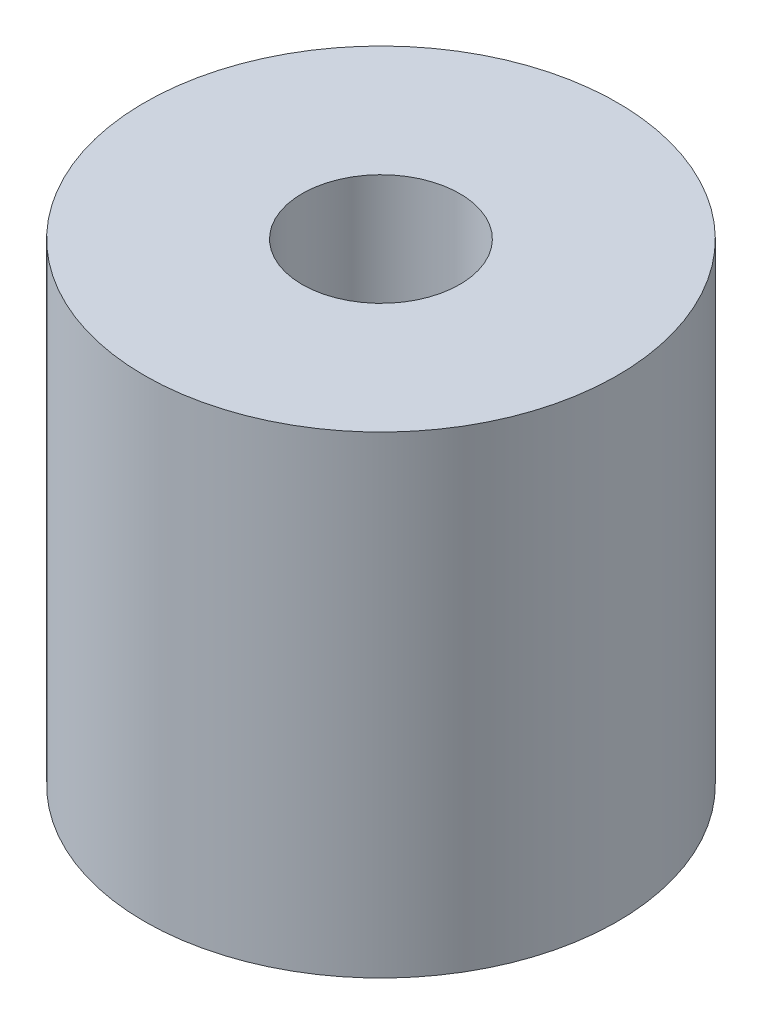
from build123d import *

# Parameters (mm, degrees)
SKETCH1_R           = 6
SKETCH1_R_2         = 2
BOSS_EXTRUDE1_DEPTH = 12


with BuildPart() as part:
    # Sketch1 → Boss-Extrude1 (new body)
    with BuildSketch(Plane(origin=(0, 0, 0), x_dir=(1, 0, 0), z_dir=(0, 1, 0))):
        with Locations(Location((0, 0, 0), (0, 0, 270))):
            Circle(SKETCH1_R)
        with Locations(Location((0, 0, 0), (0, 0, 270))):
            Circle(SKETCH1_R_2, mode=Mode.SUBTRACT)
    extrude(amount=BOSS_EXTRUDE1_DEPTH)


solid = part.part
